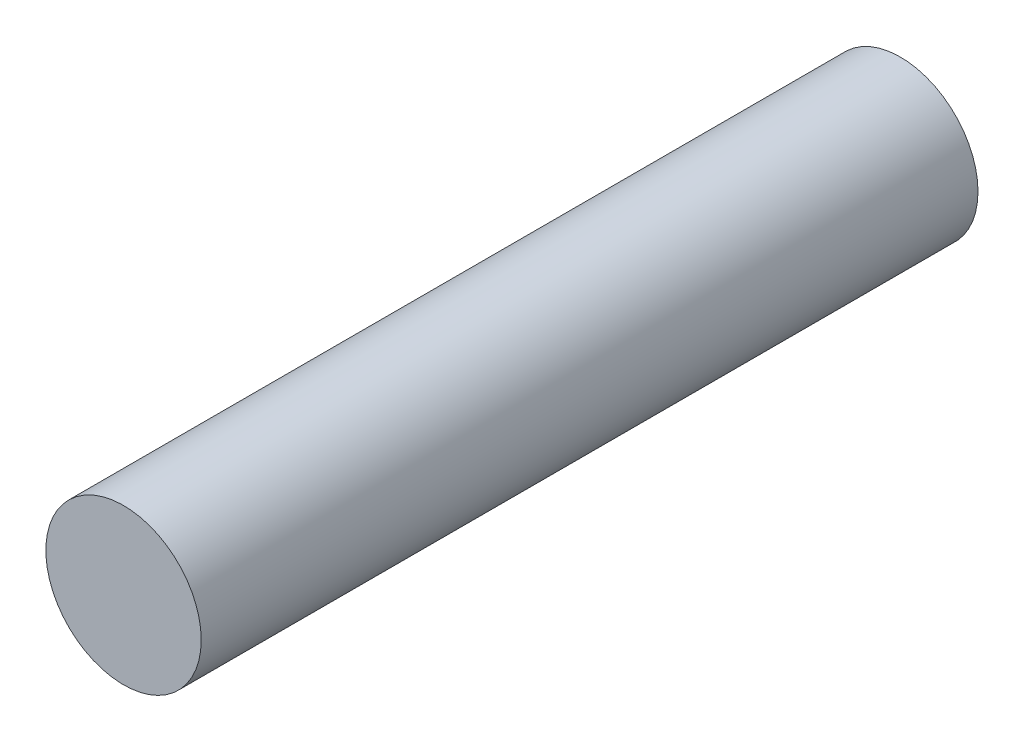
from build123d import *

# Parameters (mm, degrees)
ESQUISSE1_R        = 1.5
BOSS_EXTRU_1_DEPTH = 7.5


with BuildPart() as part:
    # Esquisse1 → Boss.-Extru.1 (new, symmetric)
    with BuildSketch(Plane.XY):
        Circle(ESQUISSE1_R)
    extrude(amount=BOSS_EXTRU_1_DEPTH, both=True)


solid = part.part
